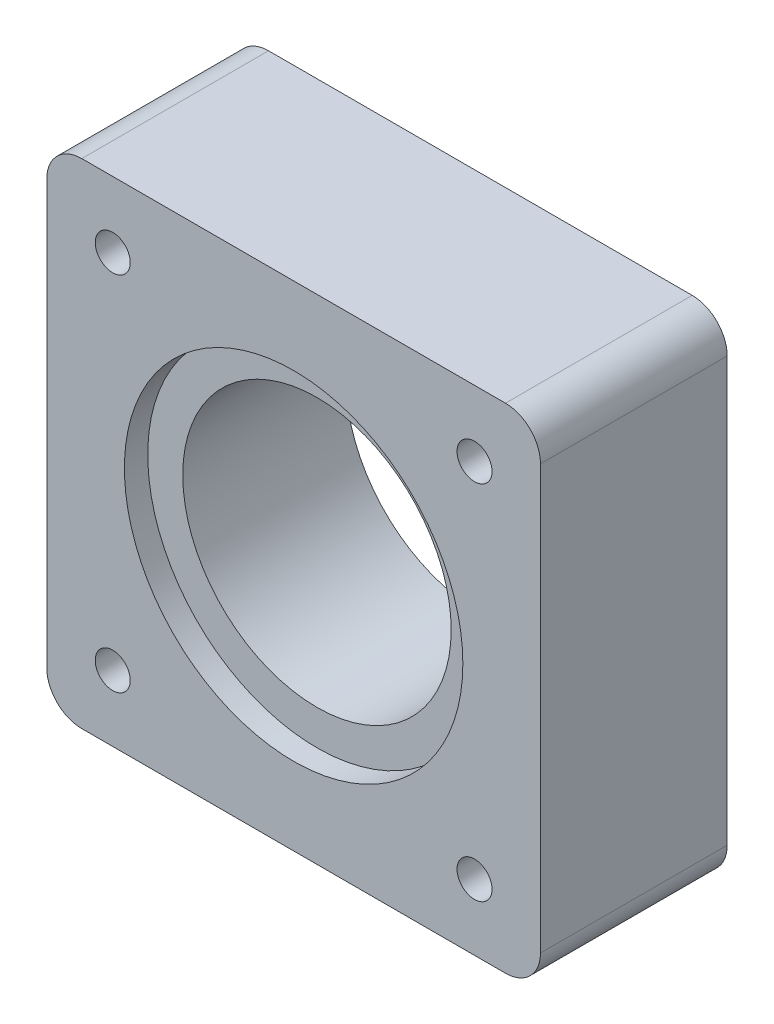
from build123d import *

# Parameters (mm, degrees)
ESQUISSE1_W             = 42.3
ESQUISSE1_H             = 42.3
BOSS_EXTRU_1_DEPTH      = 16
ESQUISSE2_R             = 1.5
ENL_V_MAT_EXTRU_2_DEPTH = 62.92398566
CONG_1_R                = 3
CONG_2_R                = 3
ESQUISSE4_R             = 11.5
ENL_V_MAT_EXTRU_4_DEPTH = 62.92398566
ESQUISSE5_R             = 2.85
ENL_V_MAT_EXTRU_5_DEPTH = 10
ESQUISSE6_R             = 4.35
ENL_V_MAT_EXTRU_6_DEPTH = 12
ESQUISSE7_R             = 14.5
ENL_V_MAT_EXTRU_7_DEPTH = 2


with BuildPart() as part:
    # Esquisse1 → Boss.-Extru.1 (new body)
    with BuildSketch(Plane.XY):
        with Locations((21.15, 21.15)):
            Rectangle(ESQUISSE1_W, ESQUISSE1_H)
    extrude(amount=BOSS_EXTRU_1_DEPTH)

    # Esquisse2 → Enlèv. mat.-Extru.2 (cut, through all)
    with BuildSketch(Plane.XY):
        with Locations((36.65, 36.65)):
            Circle(ESQUISSE2_R)
        with Locations((5.65, 36.65)):
            Circle(ESQUISSE2_R)
        with Locations((5.65, 5.65)):
            Circle(ESQUISSE2_R)
        with Locations((36.65, 5.65)):
            Circle(ESQUISSE2_R)
    extrude(amount=ENL_V_MAT_EXTRU_2_DEPTH, mode=Mode.SUBTRACT)

    # Congé1
    cong_1_edges = [part.edges().sort_by_distance(p)[0] for p in [
        (0, 42.3, 8),
        (42.3, 42.3, 8),
    ]]
    fillet(cong_1_edges, radius=CONG_1_R)

    # Congé2
    cong_2_edges = [part.edges().sort_by_distance(p)[0] for p in [
        (42.3, 0, 8),
        (0, 0, 8),
    ]]
    fillet(cong_2_edges, radius=CONG_2_R)

    # Esquisse4 → Enlèv. mat.-Extru.4 (cut, through all)
    with BuildSketch(Plane.XY):
        with Locations((21.15, 21.15)):
            Circle(ESQUISSE4_R)
    extrude(amount=ENL_V_MAT_EXTRU_4_DEPTH, mode=Mode.SUBTRACT)

    # Esquisse5 → Enlèv. mat.-Extru.5 (cut)
    with BuildSketch(Plane.XY):
        with Locations((36.65, 36.65)):
            Circle(ESQUISSE5_R)
        with Locations((5.65, 36.65)):
            Circle(ESQUISSE5_R)
        with Locations((5.65, 5.65)):
            Circle(ESQUISSE5_R)
        with Locations((36.65, 5.65)):
            Circle(ESQUISSE5_R)
    extrude(amount=ENL_V_MAT_EXTRU_5_DEPTH, mode=Mode.SUBTRACT)

    # Esquisse6 → Enlèv. mat.-Extru.6 (cut)
    with BuildSketch(Plane.XY):
        with Locations((29.3, 6.5)):
            Circle(ESQUISSE6_R)
        with Locations((13, 6.5)):
            Circle(ESQUISSE6_R)
    extrude(amount=ENL_V_MAT_EXTRU_6_DEPTH, mode=Mode.SUBTRACT)

    # Esquisse7 → Enlèv. mat.-Extru.7 (cut)
    with BuildSketch(Plane.XY.offset(16)):
        with Locations((21.15, 21.15)):
            Circle(ESQUISSE7_R)
    extrude(amount=-ENL_V_MAT_EXTRU_7_DEPTH, mode=Mode.SUBTRACT)


solid = part.part
